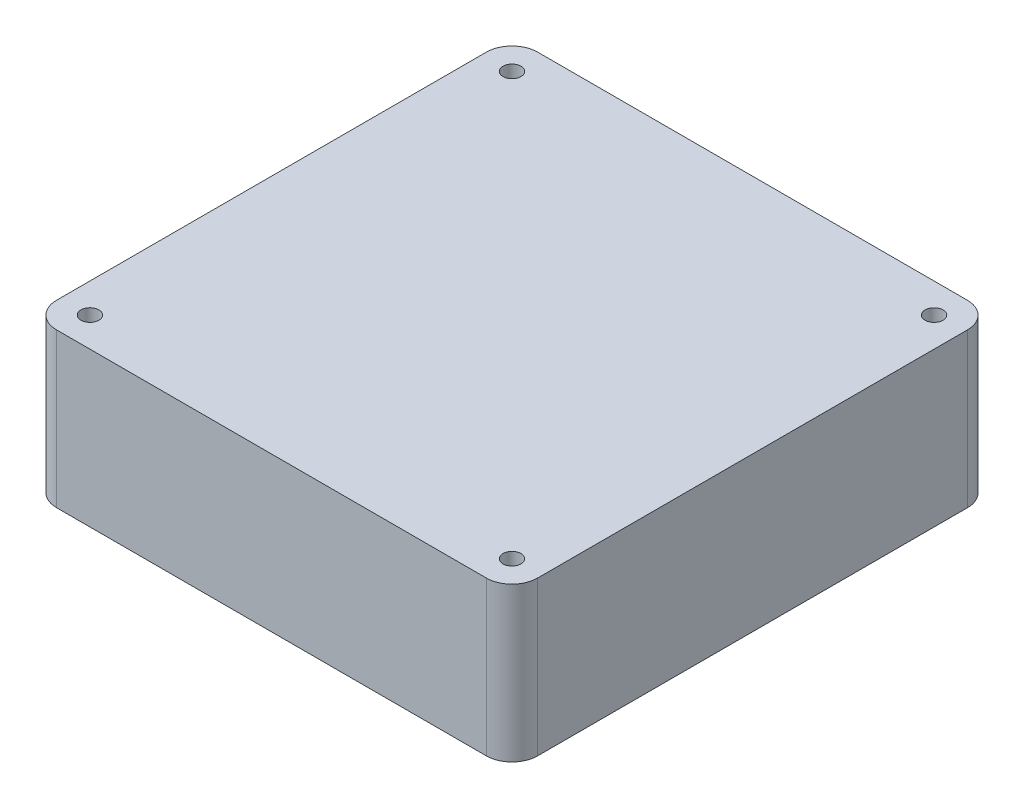
from build123d import *

# Parameters (mm, degrees)
SKETCH1_R           = 2.2225
BOSS_EXTRUDE1_DEPTH = 38.1


with BuildPart() as part:
    # Sketch1 → Boss-Extrude1 (new body)
    with BuildSketch(Plane(origin=(0, 0, 0), x_dir=(1, 0, 0), z_dir=(0, 1, 0))):
        with BuildLine():
            Line((53.145944626, -59.502675741), (-53.153055185, -59.496324046))
            ThreePointArc((-53.153055185, -59.496324046), (-57.643072104, -57.636183811), (-59.502675741, -53.145944626))
            Line((-59.502675741, -53.145944626), (-59.496324046, 53.153055185))
            ThreePointArc((-59.496324046, 53.153055185), (-57.636183811, 57.643072104), (-53.145944626, 59.502675741))
            Line((-53.145944626, 59.502675741), (53.153055185, 59.496324046))
            ThreePointArc((53.153055185, 59.496324046), (57.643072104, 57.636183811), (59.502675741, 53.145944626))
            Line((59.502675741, 53.145944626), (59.496324046, -53.153055185))
            ThreePointArc((59.496324046, -53.153055185), (57.636183811, -57.643072104), (53.145944626, -59.502675741))
        make_face()
        with Locations(Location((-52.193880974, 52.200118839, 0), (0, 0, 90))):
            Circle(SKETCH1_R, mode=Mode.SUBTRACT)
        with Locations(Location((52.200118839, 52.193880974, 0), (0, 0, 90))):
            Circle(SKETCH1_R, mode=Mode.SUBTRACT)
        with Locations(Location((52.193880974, -52.200118839, 0), (0, 0, 90))):
            Circle(SKETCH1_R, mode=Mode.SUBTRACT)
        with Locations(Location((-52.200118839, -52.193880974, 0), (0, 0, 90))):
            Circle(SKETCH1_R, mode=Mode.SUBTRACT)
    extrude(amount=BOSS_EXTRUDE1_DEPTH)


solid = part.part
